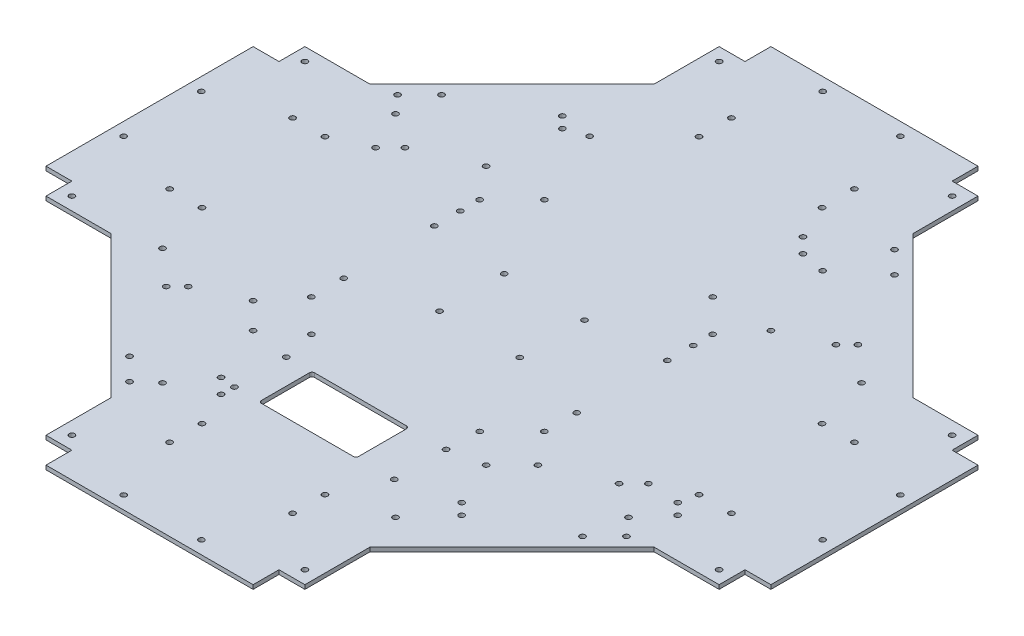
from build123d import *

# Parameters (mm, degrees)
SKETCH1_R           = 2.125
BOSS_EXTRUDE1_DEPTH = 3.175
SKETCH2_R           = 2.125
SKETCH2_W           = 75
SKETCH2_H           = 41
CUT_EXTRUDE1_DEPTH  = 396.992525971
FILLET1_R           = 2
SKETCH3_W           = 20
SKETCH3_H           = 20
CUT_EXTRUDE2_DEPTH  = 396.992525971


with BuildPart() as part:
    # Sketch1 → Boss-Extrude1 (new body)
    with BuildSketch(Plane(origin=(0, 0, 0), x_dir=(1, 0, 0), z_dir=(0, 1, 0))):
        Polygon((0, -280), (100, -280), (100, -209.601551084), (209.601551084, -100), (280, -100), (280, 0), (280, 100), (209.601551084, 100), (100, 209.601551084), (100, 280), (0, 280), (-100, 280), (-100, 209.601551084), (-209.601551084, 100), (-280, 100), (-280, 0), (-280, -100), (-209.601551084, -100), (-100, -209.601551084), (-100, -280), align=None)
        with Locations(Location((-47.5, -192, 0), (0, 0, 270))):
            Circle(SKETCH1_R, mode=Mode.SUBTRACT)
        with Locations(Location((-47.5, -217, 0), (0, 0, 270))):
            Circle(SKETCH1_R, mode=Mode.SUBTRACT)
        with Locations(Location((47.5, -217, 0), (0, 0, 270))):
            Circle(SKETCH1_R, mode=Mode.SUBTRACT)
        with Locations(Location((47.5, -192, 0), (0, 0, 270))):
            Circle(SKETCH1_R, mode=Mode.SUBTRACT)
        with Locations(Location((-192, 47.5, 0), (0, 0, 270))):
            Circle(SKETCH1_R, mode=Mode.SUBTRACT)
        with Locations(Location((-217, 47.5, 0), (0, 0, 270))):
            Circle(SKETCH1_R, mode=Mode.SUBTRACT)
        with Locations(Location((-192, -47.5, 0), (0, 0, 270))):
            Circle(SKETCH1_R, mode=Mode.SUBTRACT)
        with Locations(Location((-217, -47.5, 0), (0, 0, 270))):
            Circle(SKETCH1_R, mode=Mode.SUBTRACT)
        with Locations(Location((47.5, 192, 0), (0, 0, 270))):
            Circle(SKETCH1_R, mode=Mode.SUBTRACT)
        with Locations(Location((47.5, 217, 0), (0, 0, 270))):
            Circle(SKETCH1_R, mode=Mode.SUBTRACT)
        with Locations(Location((-47.5, 192, 0), (0, 0, 270))):
            Circle(SKETCH1_R, mode=Mode.SUBTRACT)
        with Locations(Location((-47.5, 217, 0), (0, 0, 270))):
            Circle(SKETCH1_R, mode=Mode.SUBTRACT)
        with Locations(Location((192, -47.5, 0), (0, 0, 270))):
            Circle(SKETCH1_R, mode=Mode.SUBTRACT)
        with Locations(Location((217, -47.5, 0), (0, 0, 270))):
            Circle(SKETCH1_R, mode=Mode.SUBTRACT)
        with Locations(Location((192, 47.5, 0), (0, 0, 270))):
            Circle(SKETCH1_R, mode=Mode.SUBTRACT)
        with Locations(Location((217, 47.5, 0), (0, 0, 270))):
            Circle(SKETCH1_R, mode=Mode.SUBTRACT)
        with Locations(Location((-90, -270, 0), (0, 0, 270))):
            Circle(SKETCH1_R, mode=Mode.SUBTRACT)
        with Locations(Location((-30, -270, 0), (0, 0, 270))):
            Circle(SKETCH1_R, mode=Mode.SUBTRACT)
        with Locations(Location((30, -270, 0), (0, 0, 270))):
            Circle(SKETCH1_R, mode=Mode.SUBTRACT)
        with Locations(Location((90, -270, 0), (0, 0, 270))):
            Circle(SKETCH1_R, mode=Mode.SUBTRACT)
        with Locations(Location((-270, 90, 0), (0, 0, 270))):
            Circle(SKETCH1_R, mode=Mode.SUBTRACT)
        with Locations(Location((-270, 30, 0), (0, 0, 270))):
            Circle(SKETCH1_R, mode=Mode.SUBTRACT)
        with Locations(Location((-270, -30, 0), (0, 0, 270))):
            Circle(SKETCH1_R, mode=Mode.SUBTRACT)
        with Locations(Location((-270, -90, 0), (0, 0, 270))):
            Circle(SKETCH1_R, mode=Mode.SUBTRACT)
        with Locations(Location((90, 270, 0), (0, 0, 270))):
            Circle(SKETCH1_R, mode=Mode.SUBTRACT)
        with Locations(Location((30, 270, 0), (0, 0, 270))):
            Circle(SKETCH1_R, mode=Mode.SUBTRACT)
        with Locations(Location((-30, 270, 0), (0, 0, 270))):
            Circle(SKETCH1_R, mode=Mode.SUBTRACT)
        with Locations(Location((-90, 270, 0), (0, 0, 270))):
            Circle(SKETCH1_R, mode=Mode.SUBTRACT)
        with Locations(Location((270, -90, 0), (0, 0, 270))):
            Circle(SKETCH1_R, mode=Mode.SUBTRACT)
        with Locations(Location((270, -30, 0), (0, 0, 270))):
            Circle(SKETCH1_R, mode=Mode.SUBTRACT)
        with Locations(Location((270, 30, 0), (0, 0, 270))):
            Circle(SKETCH1_R, mode=Mode.SUBTRACT)
        with Locations(Location((270, 90, 0), (0, 0, 270))):
            Circle(SKETCH1_R, mode=Mode.SUBTRACT)
        with Locations(Location((-90, -250, 0), (0, 0, 270))):
            Circle(SKETCH1_R, mode=Mode.SUBTRACT)
        with Locations(Location((-90, -180, 0), (0, 0, 270))):
            Circle(SKETCH1_R, mode=Mode.SUBTRACT)
        with Locations(Location((-90, -110, 0), (0, 0, 270))):
            Circle(SKETCH1_R, mode=Mode.SUBTRACT)
        with Locations(Location((-90, -40, 0), (0, 0, 270))):
            Circle(SKETCH1_R, mode=Mode.SUBTRACT)
        with Locations(Location((-90, 30, 0), (0, 0, 270))):
            Circle(SKETCH1_R, mode=Mode.SUBTRACT)
        with Locations(Location((-90, 50, 0), (0, 0, 270))):
            Circle(SKETCH1_R, mode=Mode.SUBTRACT)
        with Locations(Location((-90, 150, 0), (0, 0, 270))):
            Circle(SKETCH1_R, mode=Mode.SUBTRACT)
        with Locations(Location((-90, 250, 0), (0, 0, 270))):
            Circle(SKETCH1_R, mode=Mode.SUBTRACT)
        with Locations(Location((90, -250, 0), (0, 0, 270))):
            Circle(SKETCH1_R, mode=Mode.SUBTRACT)
        with Locations(Location((90, -180, 0), (0, 0, 270))):
            Circle(SKETCH1_R, mode=Mode.SUBTRACT)
        with Locations(Location((90, -110, 0), (0, 0, 270))):
            Circle(SKETCH1_R, mode=Mode.SUBTRACT)
        with Locations(Location((90, -40, 0), (0, 0, 270))):
            Circle(SKETCH1_R, mode=Mode.SUBTRACT)
        with Locations(Location((90, 30, 0), (0, 0, 270))):
            Circle(SKETCH1_R, mode=Mode.SUBTRACT)
        with Locations(Location((90, 50, 0), (0, 0, 270))):
            Circle(SKETCH1_R, mode=Mode.SUBTRACT)
        with Locations(Location((90, 150, 0), (0, 0, 270))):
            Circle(SKETCH1_R, mode=Mode.SUBTRACT)
        with Locations(Location((90, 250, 0), (0, 0, 270))):
            Circle(SKETCH1_R, mode=Mode.SUBTRACT)
        with Locations(Location((-250, -90, 0), (0, 0, 270))):
            Circle(SKETCH1_R, mode=Mode.SUBTRACT)
        with Locations(Location((-180, -90, 0), (0, 0, 270))):
            Circle(SKETCH1_R, mode=Mode.SUBTRACT)
        with Locations(Location((-110, -90, 0), (0, 0, 270))):
            Circle(SKETCH1_R, mode=Mode.SUBTRACT)
        with Locations(Location((-110, 90, 0), (0, 0, 270))):
            Circle(SKETCH1_R, mode=Mode.SUBTRACT)
        with Locations(Location((-180, 90, 0), (0, 0, 270))):
            Circle(SKETCH1_R, mode=Mode.SUBTRACT)
        with Locations(Location((-250, 90, 0), (0, 0, 270))):
            Circle(SKETCH1_R, mode=Mode.SUBTRACT)
        with Locations(Location((110, -90, 0), (0, 0, 270))):
            Circle(SKETCH1_R, mode=Mode.SUBTRACT)
        with Locations(Location((180, -90, 0), (0, 0, 270))):
            Circle(SKETCH1_R, mode=Mode.SUBTRACT)
        with Locations(Location((250, -90, 0), (0, 0, 270))):
            Circle(SKETCH1_R, mode=Mode.SUBTRACT)
        with Locations(Location((110, 90, 0), (0, 0, 270))):
            Circle(SKETCH1_R, mode=Mode.SUBTRACT)
        with Locations(Location((180, 90, 0), (0, 0, 270))):
            Circle(SKETCH1_R, mode=Mode.SUBTRACT)
        with Locations(Location((250, 90, 0), (0, 0, 270))):
            Circle(SKETCH1_R, mode=Mode.SUBTRACT)
    extrude(amount=BOSS_EXTRUDE1_DEPTH)

    # Sketch2 → Cut-Extrude1 (cut, through all)
    with BuildSketch(Plane(origin=(0, 3.175, 0), x_dir=(1, 0, 0), z_dir=(0, 1, 0))):
        with Locations(Location((-31, 25, 0), (0, 0, 270))):
            Circle(SKETCH2_R)
        with Locations(Location((-31, -25, 0), (0, 0, 270))):
            Circle(SKETCH2_R)
        with Locations(Location((31, -25, 0), (0, 0, 90))):
            Circle(SKETCH2_R)
        with Locations(Location((31, 25, 0), (0, 0, 90))):
            Circle(SKETCH2_R)
        with Locations(Location((-90, 65, 0), (0, 0, 270))):
            Circle(SKETCH2_R)
        with Locations(Location((-65, 90, 0), (0, 0, 270))):
            Circle(SKETCH2_R)
        with Locations(Location((65, 90, 0), (0, 0, 270))):
            Circle(SKETCH2_R)
        with Locations(Location((90, 65, 0), (0, 0, 270))):
            Circle(SKETCH2_R)
        with Locations(Location((90, -65, 0), (0, 0, 270))):
            Circle(SKETCH2_R)
        with Locations(Location((65, -90, 0), (0, 0, 270))):
            Circle(SKETCH2_R)
        with Locations(Location((-65, -90, 0), (0, 0, 270))):
            Circle(SKETCH2_R)
        with Locations(Location((-90, -65, 0), (0, 0, 270))):
            Circle(SKETCH2_R)
        with Locations(Location((64.065141092, -115, 0), (0, 0, 270))):
            Circle(SKETCH2_R)
        with Locations(Location((64.065141092, -155, 0), (0, 0, 90))):
            Circle(SKETCH2_R)
        with Locations(Location((-59.434858908, -115, 0), (0, 0, 270))):
            Circle(SKETCH2_R)
        with Locations(Location((-59.434858908, -155, 0), (0, 0, 90))):
            Circle(SKETCH2_R)
        with Locations(Location((174.953318806, -120.506096654, 0), (0, 0, 270))):
            Circle(SKETCH2_R)
        with Locations(Location((191.923881554, -103.535533906, 0), (0, 0, 270))):
            Circle(SKETCH2_R)
        with Locations(Location((153.736977236, -71.011760106, 0), (0, 0, 270))):
            Circle(SKETCH2_R)
        with Locations(Location((165.050685735, -59.698051607, 0), (0, 0, 270))):
            Circle(SKETCH2_R)
        with Locations(Location((-71.011760106, -153.736977236, 0), (0, 0, 270))):
            Circle(SKETCH2_R)
        with Locations(Location((-59.698051607, -165.050685735, 0), (0, 0, 270))):
            Circle(SKETCH2_R)
        with Locations(Location((-120.506096654, -174.953318806, 0), (0, 0, 270))):
            Circle(SKETCH2_R)
        with Locations(Location((-103.535533906, -191.923881554, 0), (0, 0, 270))):
            Circle(SKETCH2_R)
        with Locations(Location((-153.736977236, 71.011760106, 0), (0, 0, 270))):
            Circle(SKETCH2_R)
        with Locations(Location((-165.050685735, 59.698051607, 0), (0, 0, 270))):
            Circle(SKETCH2_R)
        with Locations(Location((-174.953318806, 120.506096654, 0), (0, 0, 270))):
            Circle(SKETCH2_R)
        with Locations(Location((-191.923881554, 103.535533906, 0), (0, 0, 270))):
            Circle(SKETCH2_R)
        with Locations(Location((71.011760106, 153.736977236, 0), (0, 0, 270))):
            Circle(SKETCH2_R)
        with Locations(Location((59.698051607, 165.050685735, 0), (0, 0, 270))):
            Circle(SKETCH2_R)
        with Locations(Location((120.506096654, 174.953318806, 0), (0, 0, 270))):
            Circle(SKETCH2_R)
        with Locations(Location((103.535533906, 191.923881554, 0), (0, 0, 270))):
            Circle(SKETCH2_R)
        with Locations(Location((114.142135624, -153.033008589, 0), (0, 0, 270))):
            Circle(SKETCH2_R)
        with Locations(Location((105.656854249, -144.547727215, 0), (0, 0, 270))):
            Circle(SKETCH2_R)
        with Locations(Location((-144.547727215, -105.656854249, 0), (0, 0, 270))):
            Circle(SKETCH2_R)
        with Locations(Location((-153.033008589, -114.142135624, 0), (0, 0, 270))):
            Circle(SKETCH2_R)
        with Locations(Location((-105.656854249, 144.547727215, 0), (0, 0, 270))):
            Circle(SKETCH2_R)
        with Locations(Location((-114.142135624, 153.033008589, 0), (0, 0, 270))):
            Circle(SKETCH2_R)
        with Locations(Location((144.547727215, 105.656854249, 0), (0, 0, 270))):
            Circle(SKETCH2_R)
        with Locations(Location((153.033008589, 114.142135624, 0), (0, 0, 270))):
            Circle(SKETCH2_R)
        with Locations(Location((197.580735804, -69.594408409, 0), (0, 0, 90))):
            Circle(SKETCH2_R)
        with Locations(Location((189.09545443, -61.109127035, 0), (0, 0, 90))):
            Circle(SKETCH2_R)
        with Locations((-2.534858908, -135)):
            Rectangle(SKETCH2_W, SKETCH2_H)
    extrude(amount=-CUT_EXTRUDE1_DEPTH, mode=Mode.SUBTRACT)

    # Fillet1
    fillet1_edges = [part.edges().sort_by_distance(p)[0] for p in [
        (34.965141092, 1.5875, 114.5),
        (34.965141092, 1.5875, 155.5),
        (-40.034858908, 1.5875, 155.5),
        (-40.034858908, 1.5875, 114.5),
    ]]
    fillet(fillet1_edges, radius=FILLET1_R)

    # Sketch3 → Cut-Extrude2 (cut, through all)
    with BuildSketch(Plane(origin=(0, 3.175, 0), x_dir=(1, 0, 0), z_dir=(0, 1, 0))):
        with Locations((90, -270)):
            Rectangle(SKETCH3_W, SKETCH3_H)
        with Locations((-90, -270)):
            Rectangle(SKETCH3_W, SKETCH3_H)
        with Locations((-270, 90)):
            Rectangle(SKETCH3_W, SKETCH3_H)
        with Locations((-270, -90)):
            Rectangle(SKETCH3_W, SKETCH3_H)
        with Locations((90, 270)):
            Rectangle(SKETCH3_W, SKETCH3_H)
        with Locations((-90, 270)):
            Rectangle(SKETCH3_W, SKETCH3_H)
        with Locations((270, -90)):
            Rectangle(SKETCH3_W, SKETCH3_H)
        with Locations((270, 90)):
            Rectangle(SKETCH3_W, SKETCH3_H)
    extrude(amount=-CUT_EXTRUDE2_DEPTH, mode=Mode.SUBTRACT)


solid = part.part
